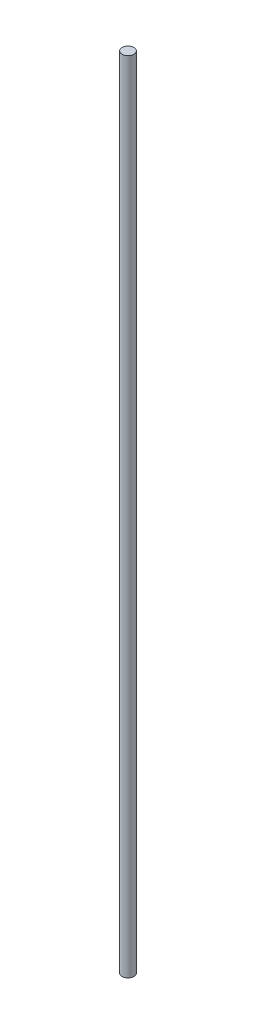
from build123d import *

# Parameters (mm, degrees)
SKETCH1_R           = 1.5
BOSS_EXTRUDE1_DEPTH = 202


with BuildPart() as part:
    # Sketch1 → Boss-Extrude1 (new body)
    with BuildSketch(Plane(origin=(0, 0, 0), x_dir=(1, 0, 0), z_dir=(0, 1, 0))):
        with Locations(Location((0, 0, 0), (0, 0, 270))):
            Circle(SKETCH1_R)
    extrude(amount=BOSS_EXTRUDE1_DEPTH)


solid = part.part
